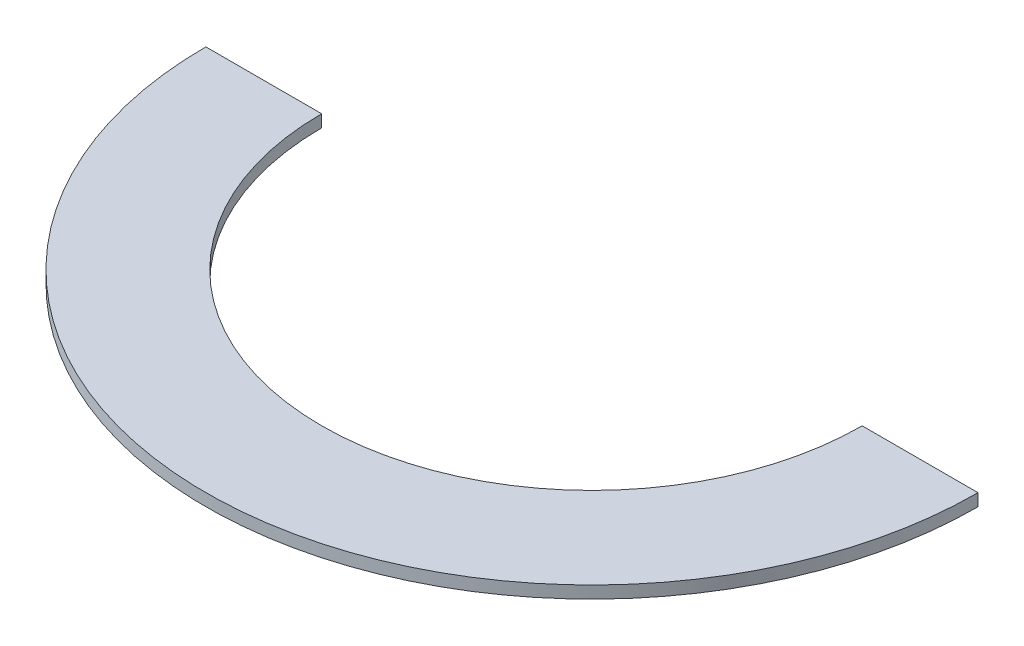
from build123d import *

# Parameters (mm, degrees)
BOSS_EXTRUDE1_DEPTH = 1.5875


with BuildPart() as part:
    # Sketch1 → Boss-Extrude1 (new body)
    with BuildSketch(Plane(origin=(0, 0, 0), x_dir=(1, 0, 0), z_dir=(0, 1, 0))):
        with BuildLine():
            Line((-50, 0), (-35, 0))
            ThreePointArc((-35, 0), (0, -35), (35, 0))
            Line((35, 0), (50, 0))
            ThreePointArc((50, 0), (0, -50), (-50, 0))
        make_face()
    extrude(amount=BOSS_EXTRUDE1_DEPTH)


solid = part.part
